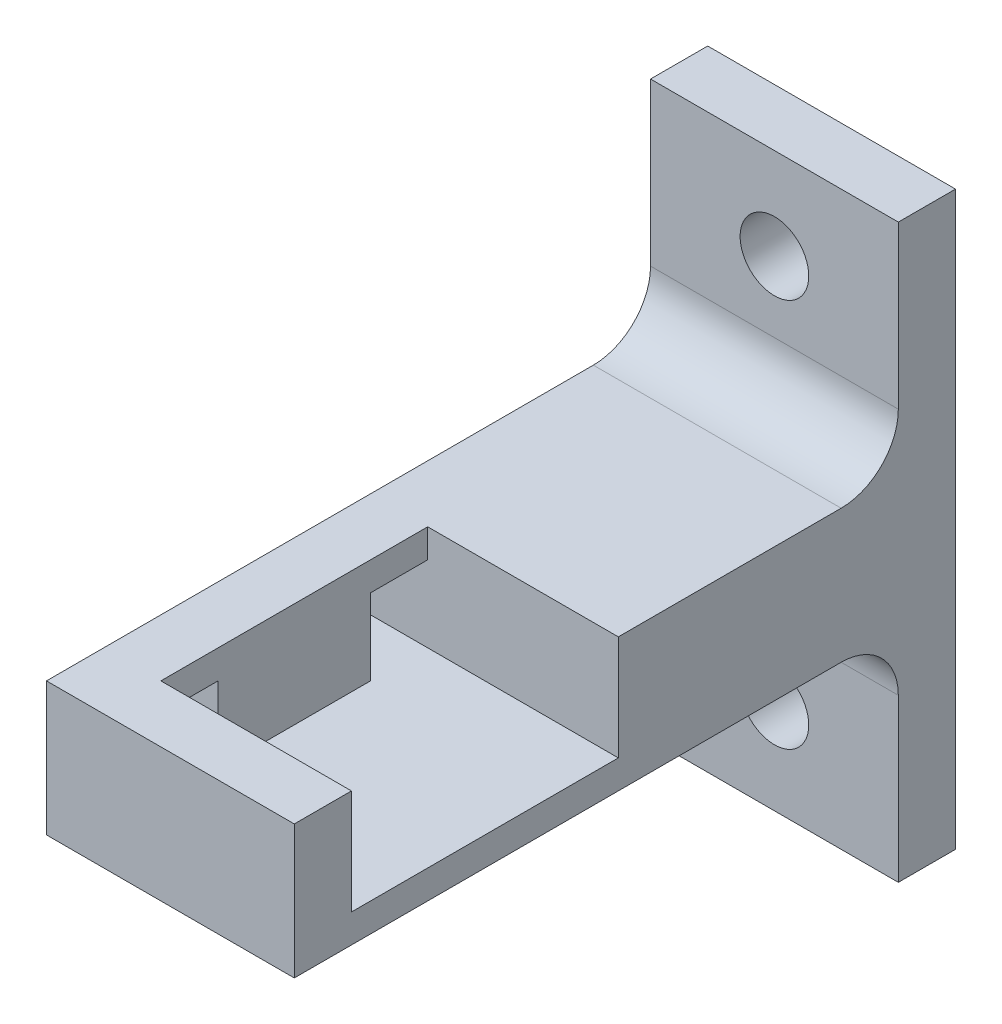
from build123d import *

# Parameters (mm, degrees)
SKETCH1_W           = 13
SKETCH1_H           = 30
SKETCH1_R           = 1.8
BOSS_EXTRUDE1_DEPTH = 3
SKETCH2_W           = 13
SKETCH2_H           = 7
BOSS_EXTRUDE2_DEPTH = 31.69
SKETCH3_W           = 10
SKETCH3_H           = 14
CUT_EXTRUDE1_DEPTH  = 5.5
SKETCH4_W           = 3
SKETCH4_H           = 4
CUT_EXTRUDE2_DEPTH  = 47.940346185
FILLET1_R           = 3


with BuildPart() as part:
    # Sketch1 → Boss-Extrude1 (new body)
    with BuildSketch(Plane.XY):
        with Locations((6.5, 15)):
            Rectangle(SKETCH1_W, SKETCH1_H)
        with Locations((6.5, 25.2)):
            Circle(SKETCH1_R, mode=Mode.SUBTRACT)
        with Locations((6.5, 4.8)):
            Circle(SKETCH1_R, mode=Mode.SUBTRACT)
    extrude(amount=BOSS_EXTRUDE1_DEPTH)

    # Sketch2 → Boss-Extrude2 (add)
    with BuildSketch(Plane.XY.offset(3)):
        with Locations((6.5, 15)):
            Rectangle(SKETCH2_W, SKETCH2_H)
    extrude(amount=BOSS_EXTRUDE2_DEPTH)

    # Sketch3 → Cut-Extrude1 (cut)
    with BuildSketch(Plane(origin=(0, 18.5, 0), x_dir=(1, 0, 0), z_dir=(0, 1, 0))):
        with Locations((8, -24.69)):
            Rectangle(SKETCH3_W, SKETCH3_H)
    extrude(amount=-CUT_EXTRUDE1_DEPTH, mode=Mode.SUBTRACT)

    # Sketch4 → Cut-Extrude2 (cut, through all)
    with BuildSketch(Plane(origin=(3, 0, 0), x_dir=(0, 0, -1), z_dir=(1, 0, 0))):
        with Locations((-30.19, 15)):
            Rectangle(SKETCH4_W, SKETCH4_H)
        with Locations((-19.19, 15)):
            Rectangle(SKETCH4_W, SKETCH4_H)
    extrude(amount=-CUT_EXTRUDE2_DEPTH, mode=Mode.SUBTRACT)

    # Fillet1
    fillet1_edges = [part.edges().sort_by_distance(p)[0] for p in [
        (6.5, 11.5, 3),
        (6.5, 18.5, 3),
    ]]
    fillet(fillet1_edges, radius=FILLET1_R)


solid = part.part
